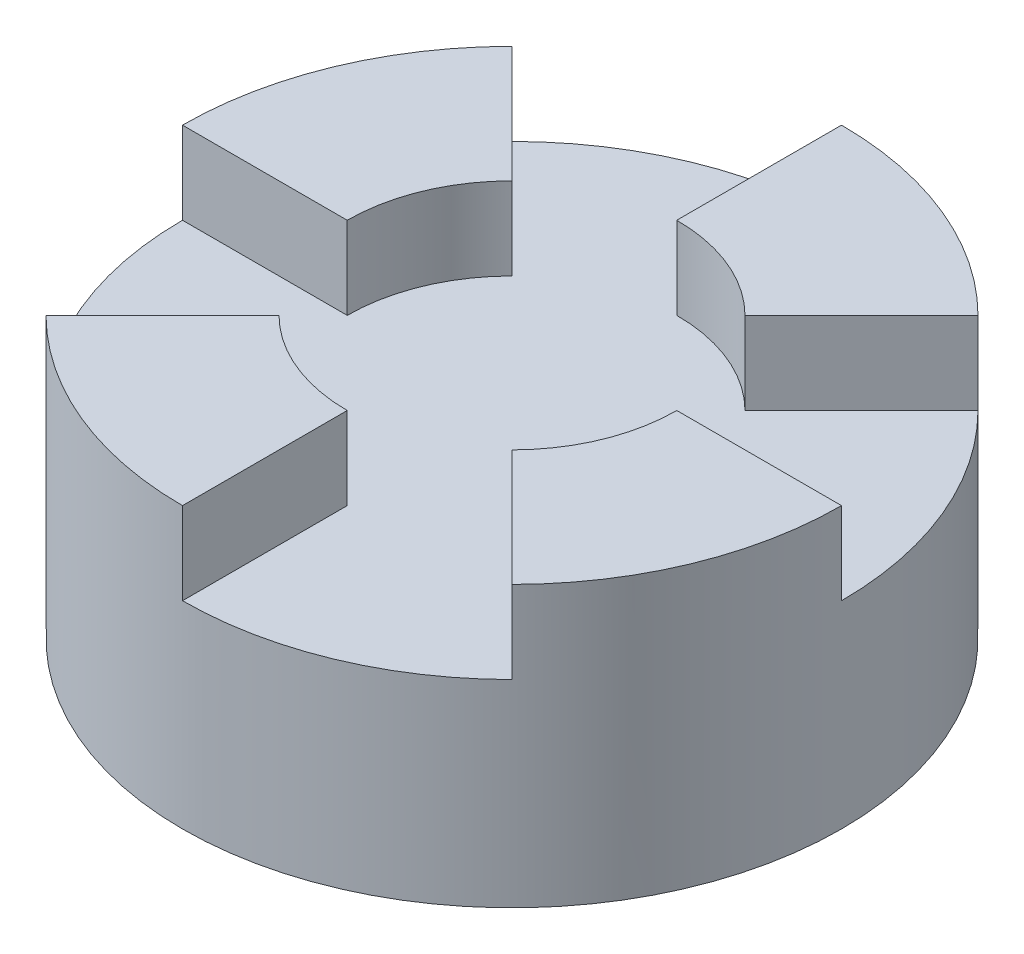
from build123d import *

# Parameters (mm, degrees)
SKETCH1_R                      = 20
EXTRUDE_MECHANISM_PART_1_DEPTH = 17
CUT_START                      = -5
CUT_MECHANISM_PART_1_DEPTH     = 5


with BuildPart() as part:
    # Sketch1 → Extrude (Mechanism Part 1) (new body)
    with BuildSketch(Plane(origin=(0, 0, 0), x_dir=(1, 0, 0), z_dir=(0, 1, 0))):
        with Locations(Location((0, 0, 0), (0, 0, 270))):
            Circle(SKETCH1_R)
    extrude(amount=EXTRUDE_MECHANISM_PART_1_DEPTH)

    # Sketch2 → Cut (Mechanism Part 1) (cut)
    with BuildSketch(Plane(origin=(0, 17, 0), x_dir=(1, 0, 0), z_dir=(0, 1, 0)).offset(CUT_START)):
        with BuildLine():
            Line((0, 10), (0, 20))
            ThreePointArc((0, 20), (-7.653668647, 18.47759065), (-14.142135624, 14.142135624))
            Line((-14.142135624, 14.142135624), (-7.071067812, 7.071067812))
            ThreePointArc((-7.071067812, 7.071067812), (-3.826834324, 9.238795325), (0, 10))
        make_face()
        with BuildLine():
            ThreePointArc((20, 0), (18.47759065, 7.653668647), (14.142135624, 14.142135624))
            Line((14.142135624, 14.142135624), (7.071067812, 7.071067812))
            ThreePointArc((7.071067812, 7.071067812), (9.238795325, 3.826834324), (10, 0))
            Line((10, 0), (20, 0))
        make_face()
        with BuildLine():
            ThreePointArc((7.071067812, -7.071067812), (3.826834324, -9.238795325), (0, -10))
            Line((0, -10), (0, -20))
            ThreePointArc((0, -20), (7.653668647, -18.47759065), (14.142135624, -14.142135624))
            Line((14.142135624, -14.142135624), (7.071067812, -7.071067812))
        make_face()
        with BuildLine():
            Line((-10, 0), (-20, 0))
            ThreePointArc((-20, 0), (-18.47759065, -7.653668647), (-14.142135624, -14.142135624))
            Line((-14.142135624, -14.142135624), (-7.071067812, -7.071067812))
            ThreePointArc((-7.071067812, -7.071067812), (-9.238795325, -3.826834324), (-10, 0))
        make_face()
        with BuildLine():
            Line((-7.071067812, -7.071067812), (0, 0))
            Line((0, 0), (-10, 0))
            ThreePointArc((-10, 0), (-9.238795325, -3.826834324), (-7.071067812, -7.071067812))
        make_face()
        with BuildLine():
            Line((-10, 0), (0, 0))
            Line((0, 0), (-7.071067812, 7.071067812))
            ThreePointArc((-7.071067812, 7.071067812), (-9.238795325, 3.826834324), (-10, 0))
        make_face()
        with BuildLine():
            Line((0, 0), (0, 10))
            ThreePointArc((0, 10), (-3.826834324, 9.238795325), (-7.071067812, 7.071067812))
            Line((-7.071067812, 7.071067812), (0, 0))
        make_face()
        with BuildLine():
            ThreePointArc((7.071067812, 7.071067812), (3.826834324, 9.238795325), (0, 10))
            Line((0, 10), (0, 0))
            Line((0, 0), (7.071067812, 7.071067812))
        make_face()
        with BuildLine():
            Line((7.071067812, 7.071067812), (0, 0))
            Line((0, 0), (10, 0))
            ThreePointArc((10, 0), (9.238795325, 3.826834324), (7.071067812, 7.071067812))
        make_face()
        with BuildLine():
            Line((10, 0), (0, 0))
            Line((0, 0), (7.071067812, -7.071067812))
            ThreePointArc((7.071067812, -7.071067812), (9.238795325, -3.826834324), (10, 0))
        make_face()
        with BuildLine():
            Line((7.071067812, -7.071067812), (0, 0))
            Line((0, 0), (0, -10))
            ThreePointArc((0, -10), (3.826834324, -9.238795325), (7.071067812, -7.071067812))
        make_face()
        with BuildLine():
            Line((0, -10), (0, 0))
            Line((0, 0), (-7.071067812, -7.071067812))
            ThreePointArc((-7.071067812, -7.071067812), (-3.826834324, -9.238795325), (0, -10))
        make_face()
    extrude(amount=CUT_MECHANISM_PART_1_DEPTH, mode=Mode.SUBTRACT)


solid = part.part
